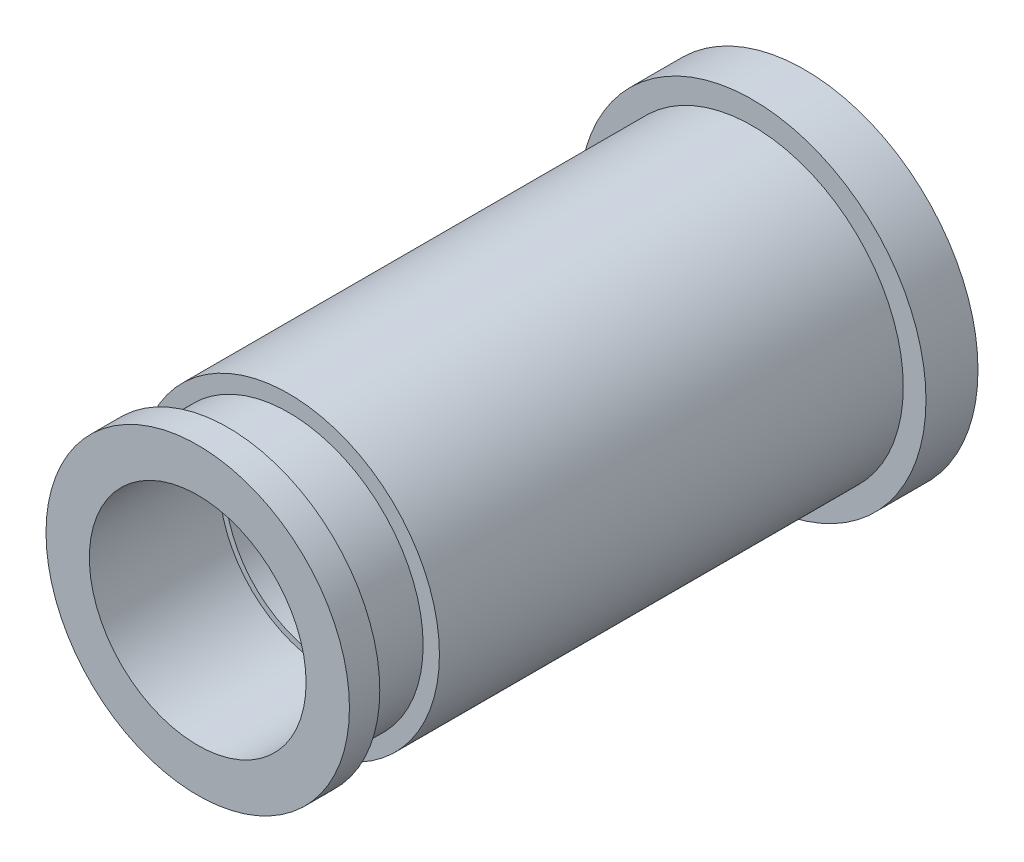
from build123d import *

# Parameters (mm, degrees)
FILLET1_R = 0.79375


with BuildPart() as part:
    # Sketch1 → Revolve1 (revolve)
    with BuildSketch(Plane(origin=(0, 0, 0), x_dir=(0, 0, -1), z_dir=(1, 0, 0)), mode=Mode.PRIVATE) as revolve1_sk:
        Polygon((-61.206526461, 19.84375), (-37.394026461, 19.84375), (-37.394026461, 18.794647739), (49.918473539, 18.794647739), (49.918473539, 31.75), (40.393473539, 31.75), (40.393473539, 27.590649684), (-44.537776461, 27.590649684), (-44.537776461, 24.60625), (-55.650276461, 24.60625), (-55.650276461, 27.78125), (-61.206526461, 27.78125), align=None)
    revolve(revolve1_sk.sketch.rotate(Axis((0, 0, 20.539691943), (0, 0, -1)), 90), axis=Axis((0, 0, 20.539691943), (0, 0, -1)))

    # Fillet1
    fillet1_edges = [part.edges().sort_by_distance(p)[0] for p in [
        (-18.794647739, 0, -49.918473539),
    ]]
    fillet(fillet1_edges, radius=FILLET1_R)


solid = part.part
